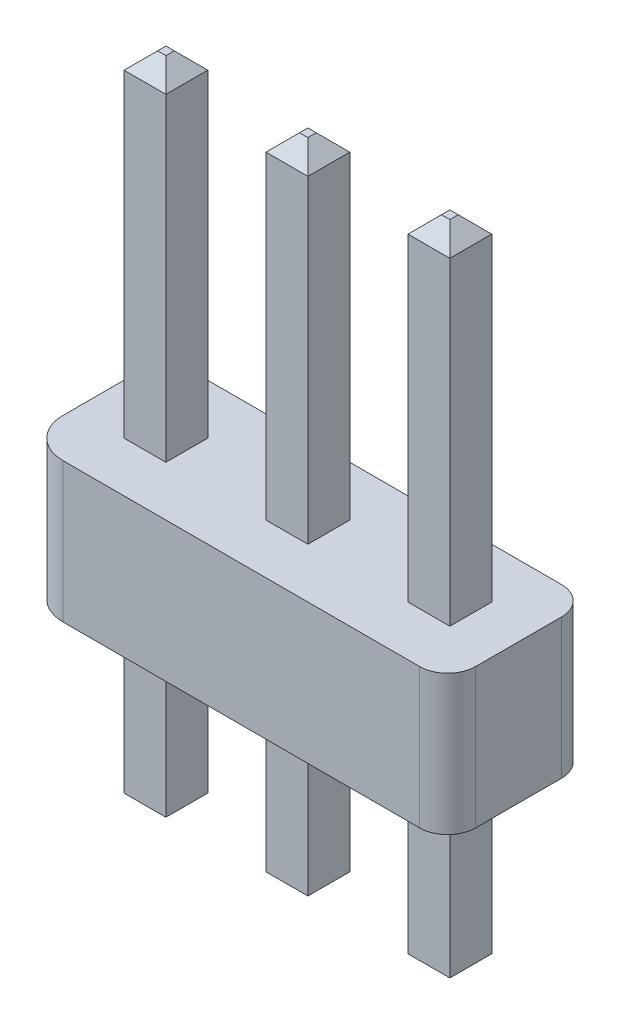
from build123d import *

# Parameters (mm, degrees)
BOSS_EXTRUDE1_DEPTH          = 2.5
BOSS_EXTRUDE2_DEPTH          = 8.5
BOSS_EXTRUDE2_DEPTH_BACK     = 3.25
SKETCH2_W                    = 0.75
SKETCH2_H                    = 0.75
CHAMFER1_SIZE                = 0.3
REDONDEO3_R                  = 0.7
SALIENTE_EXTRUIR4_DEPTH      = 5.7
SALIENTE_EXTRUIR4_DEPTH_BACK = 5.5
CROQUIS5_W                   = 0.748499393
CROQUIS5_H                   = 0.75
CROQUIS6_W                   = 0.748499393
CROQUIS6_H                   = 0.75
SALIENTE_EXTRUIR5_DEPTH      = 0.3
SALIENTE_EXTRUIR5_TAPER      = 45
CROQUIS7_W                   = 0.748499393
CROQUIS7_H                   = 0.75
SALIENTE_EXTRUIR6_DEPTH      = 0.3
SALIENTE_EXTRUIR6_TAPER      = 45


with BuildPart() as part:
    # Sketch1 → Boss-Extrude1 (new body)
    with BuildSketch(Plane(origin=(0, 0, 0), x_dir=(-1, 0, 0), z_dir=(0, 1, 0))):
        with BuildLine():
            Line((-2, 1.27), (2, 1.27))
            Line((2, 1.27), (4.545175415, 1.27))
            Line((4.545175415, 1.27), (5.081429124, 1.27))
            Line((5.081429124, 1.27), (5.081429124, -1.27))
            Line((5.081429124, -1.27), (4.545175415, -1.27))
            Line((4.545175415, -1.27), (2, -1.27))
            Line((2, -1.27), (-2, -1.27))
            ThreePointArc((-2, -1.27), (-2.353553391, -1.123553391), (-2.5, -0.77))
            Line((-2.5, -0.77), (-2.5, 0.77))
            ThreePointArc((-2.5, 0.77), (-2.353553391, 1.123553391), (-2, 1.27))
        make_face()
    extrude(amount=BOSS_EXTRUDE1_DEPTH)

    # Sketch2 → Boss-Extrude2 (add, two sides: drawn at the far end of the back side and taken through both)
    with BuildSketch(Plane(origin=(0, 0, 0), x_dir=(-1, 0, 0), z_dir=(0, 1, 0)).offset(-BOSS_EXTRUDE2_DEPTH_BACK)):
        with Locations((1.27, 0)):
            Rectangle(SKETCH2_W, SKETCH2_H)
        with Locations((-1.27, 0)):
            Rectangle(SKETCH2_W, SKETCH2_H)
    extrude(amount=BOSS_EXTRUDE2_DEPTH + BOSS_EXTRUDE2_DEPTH_BACK)

    # Chamfer1
    chamfer1_edges = [part.edges().sort_by_distance(p)[0] for p in [
        (-0.895, -3.25, 0),
        (-1.27, -3.25, 0.375),
        (-1.645, -3.25, 0),
        (-1.27, -3.25, -0.375),
        (-0.895, 8.5, 0),
        (-1.27, 8.5, -0.375),
        (-1.645, 8.5, 0),
        (-1.27, 8.5, 0.375),
        (0.895, -3.25, 0),
        (1.27, -3.25, -0.375),
        (1.645, -3.25, 0),
        (1.27, -3.25, 0.375),
        (0.895, 8.5, 0),
        (1.27, 8.5, 0.375),
        (1.645, 8.5, 0),
        (1.27, 8.5, -0.375),
    ]]
    chamfer(chamfer1_edges, length=CHAMFER1_SIZE)

    # Redondeo3
    redondeo3_edges = [part.edges().sort_by_distance(p)[0] for p in [
        (-5.081429124, 1.25, 1.27),
        (-5.081429124, 1.25, -1.27),
    ]]
    fillet(redondeo3_edges, radius=REDONDEO3_R)

    # Croquis5 → Saliente-Extruir4 (add, two sides: drawn at the far end of the back side and taken through both)
    with BuildSketch(Plane(origin=(0, 2.5, 0), x_dir=(1, 0, 0), z_dir=(0, 1, 0)).offset(-SALIENTE_EXTRUIR4_DEPTH_BACK)):
        with Locations((-3.809249697, 0)):
            Rectangle(CROQUIS5_W, CROQUIS5_H)
    extrude(amount=SALIENTE_EXTRUIR4_DEPTH + SALIENTE_EXTRUIR4_DEPTH_BACK)

    # Croquis6 → Saliente-Extruir5 (add)
    with BuildSketch(Plane(origin=(0, 8.2, 0), x_dir=(1, 0, 0), z_dir=(0, 1, 0))):
        with Locations((-3.809249697, 0)):
            Rectangle(CROQUIS6_W, CROQUIS6_H)
    extrude(amount=SALIENTE_EXTRUIR5_DEPTH, taper=SALIENTE_EXTRUIR5_TAPER)

    # Croquis7 → Saliente-Extruir6 (add)
    with BuildSketch(Plane.XZ.offset(3)):
        with Locations((-3.809249697, 0)):
            Rectangle(CROQUIS7_W, CROQUIS7_H)
    extrude(amount=SALIENTE_EXTRUIR6_DEPTH, taper=SALIENTE_EXTRUIR6_TAPER)


solid = part.part
